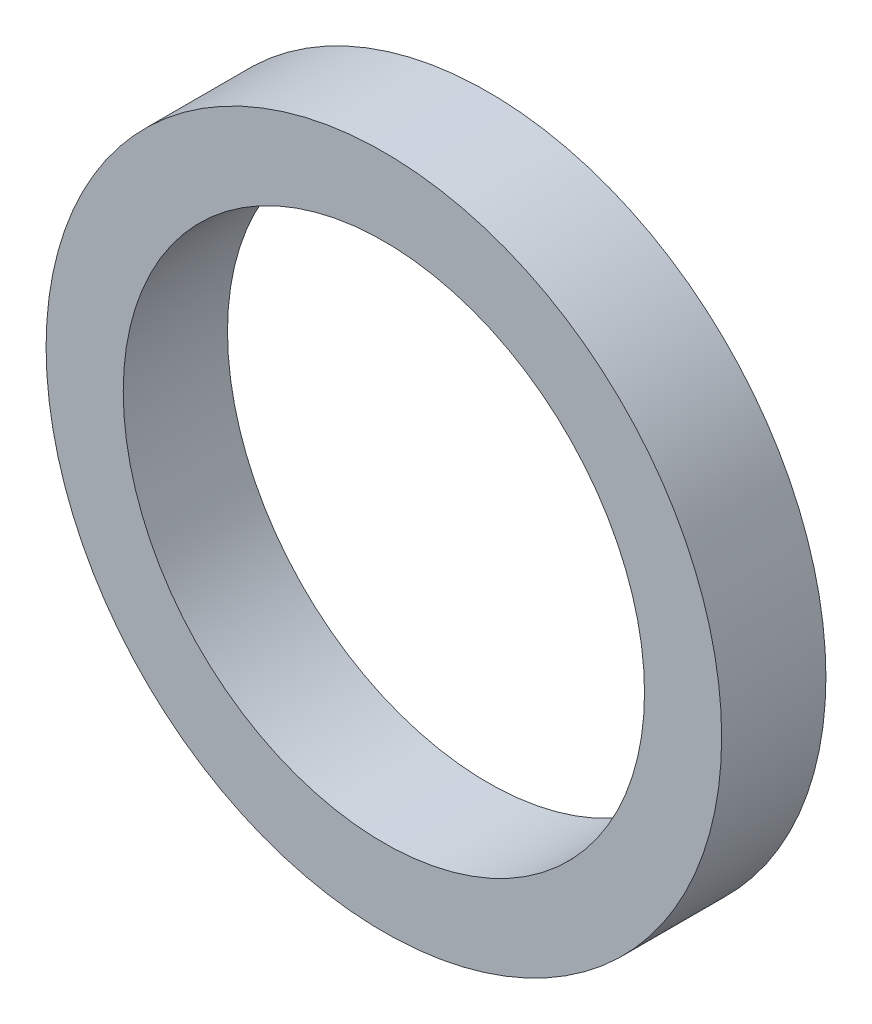
from build123d import *

# Parameters (mm, degrees)
SKETCH1_R           = 6.48
SKETCH1_R_2         = 5
BOSS_EXTRUDE1_DEPTH = 2


with BuildPart() as part:
    # Sketch1 → Boss-Extrude1 (new body)
    with BuildSketch(Plane.XY):
        Circle(SKETCH1_R)
        Circle(SKETCH1_R_2, mode=Mode.SUBTRACT)
    extrude(amount=BOSS_EXTRUDE1_DEPTH)


solid = part.part
